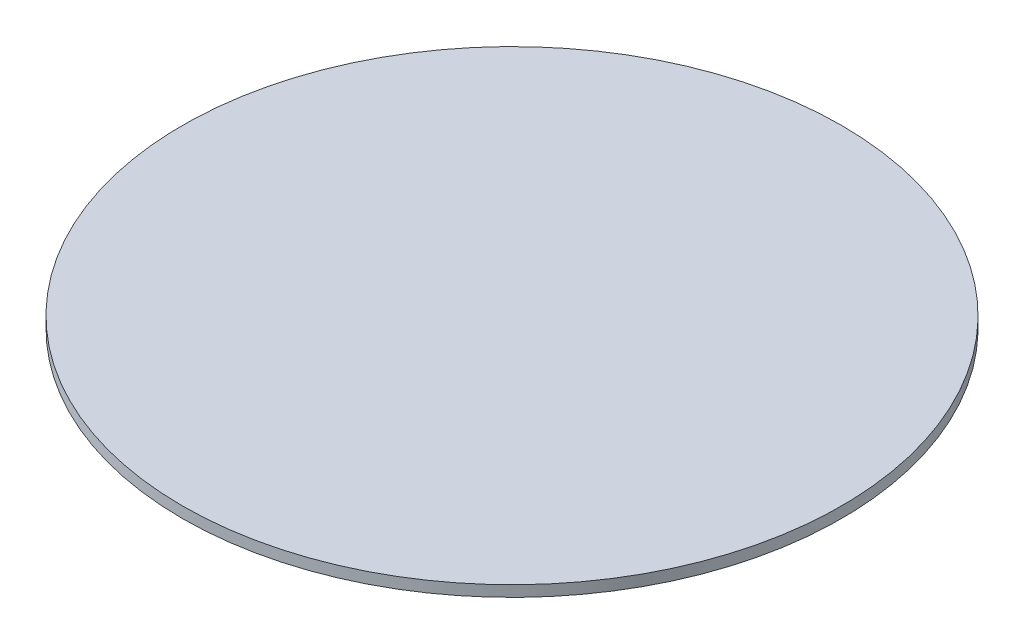
from build123d import *

# Parameters (mm, degrees)
SKETCH2_R           = 152.4
BOSS_EXTRUDE1_DEPTH = 5.08


with BuildPart() as part:
    # Sketch2 → Boss-Extrude1 (new body)
    with BuildSketch(Plane(origin=(0, 0, 0), x_dir=(1, 0, 0), z_dir=(0, 1, 0))):
        with Locations(Location((0, 0, 0), (0, 0, 270))):
            Circle(SKETCH2_R)
    extrude(amount=BOSS_EXTRUDE1_DEPTH)


solid = part.part
